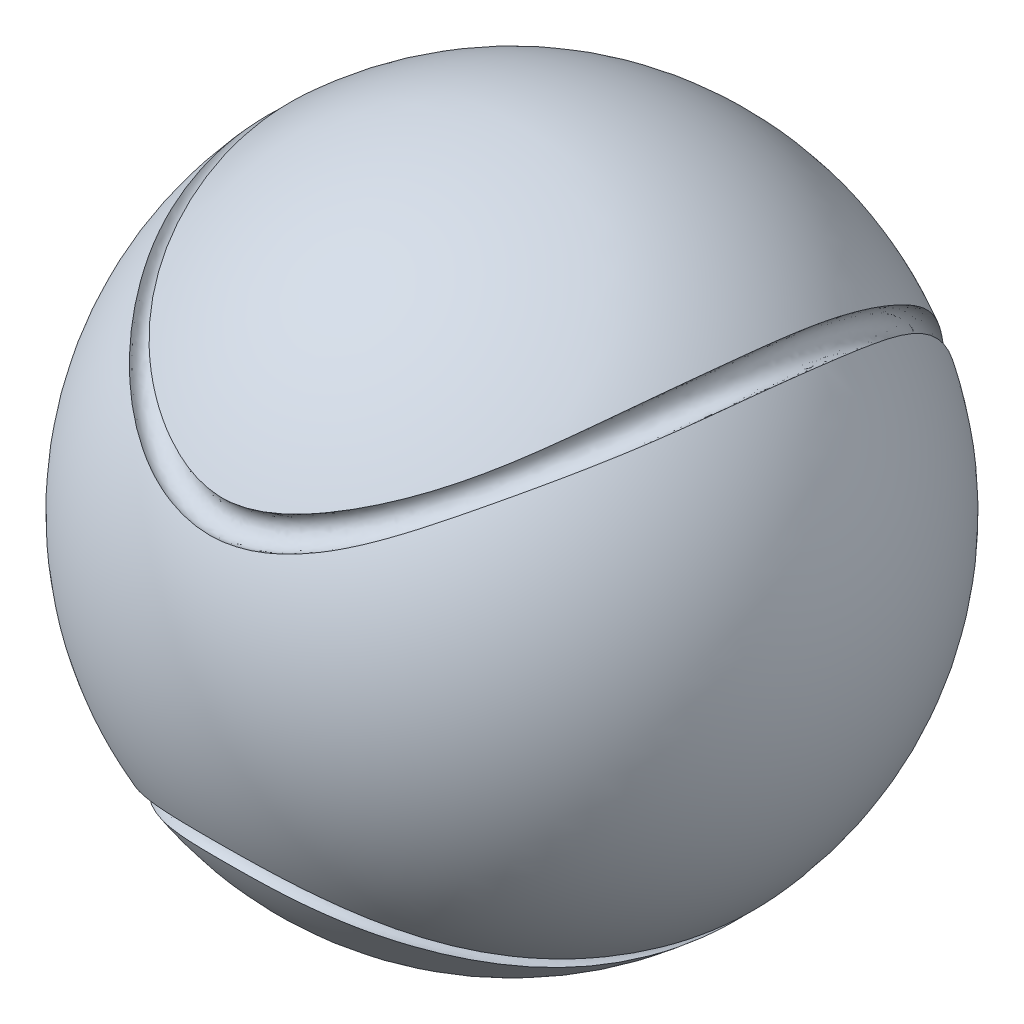
from build123d import *

# Parameters (mm, degrees)
SKETCH5_R = 1.75


with BuildPart() as part:
    # Sketch1 → Revolve-Thin3 (revolve)
    with BuildSketch(Plane(origin=(0, 0, 0), x_dir=(1, 0, 0), z_dir=(0, 1, 0))):
        with BuildLine():
            Line((0, 40), (0, -40))
            ThreePointArc((0, -40), (40, 0), (0, 40))
        make_face()
        with BuildLine():
            Line((4, 35.77708764), (4, -35.77708764))
            ThreePointArc((4, -35.77708764), (36, 0), (4, 35.77708764))
        make_face(mode=Mode.SUBTRACT)
    revolve(axis=Axis((0, 0, -40), (0, 0, 1)))

    # Cut-Sweep1: sweep along a curve in space
    with BuildLine() as cut_sweep1_path:
        add(Edge.make_bspline(
            [(-40.987322139, -40.987322139, 0), (-5.756338931, 0, -53.953104637), (-40.987322139, 40.987322139, 0), (0, 5.756338931, 53.953104637), (40.987322139, 40.987322139, 0), (5.756338931, 0, -53.953104637), (40.987322139, -40.987322139, 0), (0, -5.756338931, 53.953104637), (-40.987322139, -40.987322139, 0), (-5.756338931, 0, -53.953104637), (-40.987322139, 40.987322139, 0)],
            knots=[-0.375, -0.25, -0.125, 0, 0.125, 0.25, 0.375, 0.5, 0.625, 0.75, 0.875, 1, 1.125, 1.25, 1.375], degree=3))
    # Sketch5 → Cut-Sweep1 (sweep, cut)
    with BuildSketch(Plane(origin=(0, 0, 0), x_dir=(1, 0, 0), z_dir=(0, 1, 0))):
        with Locations((-17.5, 35.968736425)):
            Circle(SKETCH5_R)
    sweep(path=cut_sweep1_path.line, is_frenet=True, mode=Mode.SUBTRACT)


solid = part.part
